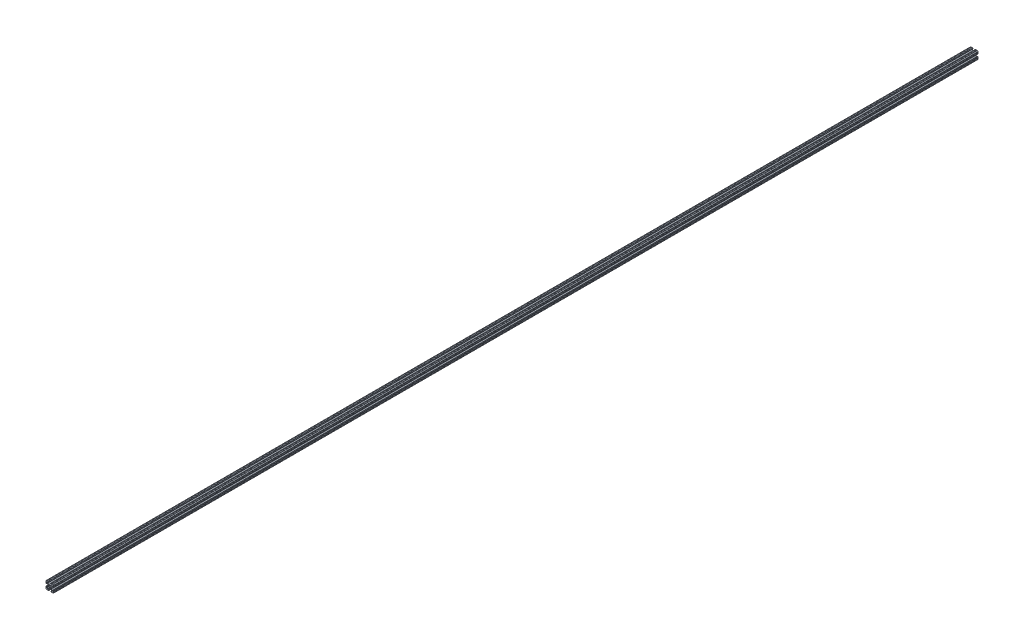
from build123d import *

# Parameters (mm, degrees)
SKETCH1_R           = 2.6035
BOSS_EXTRUDE1_DEPTH = 1524


with BuildPart() as part:
    # Sketch1 → Boss-Extrude1 (new, symmetric)
    with BuildSketch(Plane.XY):
        with BuildLine():
            Line((-7.179650497, -8.645192506), (-3.952270251, -5.423690499))
            ThreePointArc((-3.952270251, -5.423690499), (-2.922936451, -4.736929036), (-1.709253557, -4.4958))
            Line((-1.709253557, -4.4958), (1.709253557, -4.4958))
            ThreePointArc((1.709253557, -4.4958), (2.922936451, -4.736929036), (3.952270251, -5.423690499))
            Line((3.952270251, -5.423690499), (7.179650497, -8.645192506))
            ThreePointArc((7.179650497, -8.645192506), (7.41473083, -9.822813117), (6.416408329, -10.4902))
            Line((6.416408329, -10.4902), (4.287512407, -10.4902))
            ThreePointArc((4.287512407, -10.4902), (3.54574862, -10.79744862), (3.2385, -11.539212407))
            Line((3.2385, -11.539212407), (3.2385, -11.650987593))
            ThreePointArc((3.2385, -11.650987593), (3.54574862, -12.39275138), (4.287512407, -12.7))
            Line((4.287512407, -12.7), (5.317126718, -12.7))
            ThreePointArc((5.317126718, -12.7), (5.825126718, -12.192), (6.333126718, -12.7))
            Line((6.333126718, -12.7), (9.550443118, -12.7))
            ThreePointArc((9.550443118, -12.7), (10.058366869, -12.192000006), (10.566443095, -12.699847501))
            ThreePointArc((10.566443095, -12.699847501), (12.082537762, -12.08250727), (12.699846982, -10.566399977))
            ThreePointArc((12.699846982, -10.566399977), (12.192000006, -10.058323491), (12.7, -9.5504))
            Line((12.7, -9.5504), (12.7, -6.3330836))
            ThreePointArc((12.7, -6.3330836), (12.192, -5.8250836), (12.7, -5.3170836))
            Line((12.7, -5.3170836), (12.7, -4.287469289))
            ThreePointArc((12.7, -4.287469289), (12.39275138, -3.545705502), (11.650987593, -3.238456882))
            Line((11.650987593, -3.238456882), (11.539212407, -3.238456882))
            ThreePointArc((11.539212407, -3.238456882), (10.79744862, -3.545705502), (10.4902, -4.287469289))
            Line((10.4902, -4.287469289), (10.4902, -6.402089023))
            ThreePointArc((10.4902, -6.402089023), (9.856505071, -7.351067942), (8.737131347, -7.129408934))
            Line((8.737131347, -7.129408934), (5.441005833, -3.840816462))
            ThreePointArc((5.441005833, -3.840816462), (4.750877967, -2.809883091), (4.5085, -1.593185507))
            Line((4.5085, -1.593185507), (4.5085, 1.593185507))
            ThreePointArc((4.5085, 1.593185507), (4.750877967, 2.809883091), (5.441005833, 3.840816462))
            Line((5.441005833, 3.840816462), (8.737131347, 7.129408934))
            ThreePointArc((8.737131347, 7.129408934), (9.856505071, 7.351067942), (10.4902, 6.402089023))
            Line((10.4902, 6.402089023), (10.4902, 4.287469289))
            ThreePointArc((10.4902, 4.287469289), (10.79744862, 3.545705502), (11.539212407, 3.238456882))
            Line((11.539212407, 3.238456882), (11.650987593, 3.238456882))
            ThreePointArc((11.650987593, 3.238456882), (12.39275138, 3.545705502), (12.7, 4.287469289))
            Line((12.7, 4.287469289), (12.7, 5.3170836))
            ThreePointArc((12.7, 5.3170836), (12.192, 5.8250836), (12.7, 6.3330836))
            Line((12.7, 6.3330836), (12.7, 9.5504))
            ThreePointArc((12.7, 9.5504), (12.192000006, 10.058323491), (12.699846982, 10.566399977))
            ThreePointArc((12.699846982, 10.566399977), (12.082537762, 12.08250727), (10.566443095, 12.699847501))
            ThreePointArc((10.566443095, 12.699847501), (10.058366869, 12.192000006), (9.550443118, 12.7))
            Line((9.550443118, 12.7), (6.333126718, 12.7))
            ThreePointArc((6.333126718, 12.7), (5.825126718, 12.192), (5.317126718, 12.7))
            Line((5.317126718, 12.7), (4.287512407, 12.7))
            ThreePointArc((4.287512407, 12.7), (3.54574862, 12.39275138), (3.2385, 11.650987593))
            Line((3.2385, 11.650987593), (3.2385, 11.539212407))
            ThreePointArc((3.2385, 11.539212407), (3.54574862, 10.79744862), (4.287512407, 10.4902))
            Line((4.287512407, 10.4902), (6.476788598, 10.4902))
            ThreePointArc((6.476788598, 10.4902), (7.432222385, 9.85140422), (7.207036008, 8.724370562))
            Line((7.207036008, 8.724370562), (3.898272566, 5.423169045))
            ThreePointArc((3.898272566, 5.423169045), (2.869120213, 4.736787962), (1.655778399, 4.4958))
            Line((1.655778399, 4.4958), (-1.655778399, 4.4958))
            ThreePointArc((-1.655778399, 4.4958), (-2.869120213, 4.736787962), (-3.898272566, 5.423169045))
            Line((-3.898272566, 5.423169045), (-7.207036008, 8.724370562))
            ThreePointArc((-7.207036008, 8.724370562), (-7.432222385, 9.85140422), (-6.476788598, 10.4902))
            Line((-6.476788598, 10.4902), (-4.287512407, 10.4902))
            ThreePointArc((-4.287512407, 10.4902), (-3.54574862, 10.79744862), (-3.2385, 11.539212407))
            Line((-3.2385, 11.539212407), (-3.2385, 11.650987593))
            ThreePointArc((-3.2385, 11.650987593), (-3.54574862, 12.39275138), (-4.287512407, 12.7))
            Line((-4.287512407, 12.7), (-5.317126718, 12.7))
            ThreePointArc((-5.317126718, 12.7), (-5.825126718, 12.192), (-6.333126718, 12.7))
            Line((-6.333126718, 12.7), (-9.550443118, 12.7))
            ThreePointArc((-9.550443118, 12.7), (-10.058366869, 12.192000006), (-10.566443095, 12.699847501))
            ThreePointArc((-10.566443095, 12.699847501), (-12.082537762, 12.08250727), (-12.699846982, 10.566399977))
            ThreePointArc((-12.699846982, 10.566399977), (-12.192000006, 10.058323491), (-12.7, 9.5504))
            Line((-12.7, 9.5504), (-12.7, 6.3330836))
            ThreePointArc((-12.7, 6.3330836), (-12.192, 5.8250836), (-12.7, 5.3170836))
            Line((-12.7, 5.3170836), (-12.7, 4.287469289))
            ThreePointArc((-12.7, 4.287469289), (-12.39275138, 3.545705502), (-11.650987593, 3.238456882))
            Line((-11.650987593, 3.238456882), (-11.539212407, 3.238456882))
            ThreePointArc((-11.539212407, 3.238456882), (-10.79744862, 3.545705502), (-10.4902, 4.287469289))
            Line((-10.4902, 4.287469289), (-10.4902, 6.402089023))
            ThreePointArc((-10.4902, 6.402089023), (-9.856505071, 7.351067942), (-8.737131347, 7.129408934))
            Line((-8.737131347, 7.129408934), (-5.441005833, 3.840816462))
            ThreePointArc((-5.441005833, 3.840816462), (-4.750877967, 2.809883091), (-4.5085, 1.593185507))
            Line((-4.5085, 1.593185507), (-4.5085, -1.593185507))
            ThreePointArc((-4.5085, -1.593185507), (-4.750877967, -2.809883091), (-5.441005833, -3.840816462))
            Line((-5.441005833, -3.840816462), (-8.737131347, -7.129408934))
            ThreePointArc((-8.737131347, -7.129408934), (-9.856505071, -7.351067942), (-10.4902, -6.402089023))
            Line((-10.4902, -6.402089023), (-10.4902, -4.287469289))
            ThreePointArc((-10.4902, -4.287469289), (-10.79744862, -3.545705502), (-11.539212407, -3.238456882))
            Line((-11.539212407, -3.238456882), (-11.650987593, -3.238456882))
            ThreePointArc((-11.650987593, -3.238456882), (-12.39275138, -3.545705502), (-12.7, -4.287469289))
            Line((-12.7, -4.287469289), (-12.7, -5.3170836))
            ThreePointArc((-12.7, -5.3170836), (-12.192, -5.8250836), (-12.7, -6.3330836))
            Line((-12.7, -6.3330836), (-12.7, -9.5504))
            ThreePointArc((-12.7, -9.5504), (-12.192000006, -10.058323491), (-12.699846982, -10.566399977))
            ThreePointArc((-12.699846982, -10.566399977), (-12.082537762, -12.08250727), (-10.566443095, -12.699847501))
            ThreePointArc((-10.566443095, -12.699847501), (-10.058366869, -12.192000006), (-9.550443118, -12.7))
            Line((-9.550443118, -12.7), (-6.333126718, -12.7))
            ThreePointArc((-6.333126718, -12.7), (-5.825126718, -12.192), (-5.317126718, -12.7))
            Line((-5.317126718, -12.7), (-4.287512407, -12.7))
            ThreePointArc((-4.287512407, -12.7), (-3.54574862, -12.39275138), (-3.2385, -11.650987593))
            Line((-3.2385, -11.650987593), (-3.2385, -11.539212407))
            ThreePointArc((-3.2385, -11.539212407), (-3.54574862, -10.79744862), (-4.287512407, -10.4902))
            Line((-4.287512407, -10.4902), (-6.416408329, -10.4902))
            ThreePointArc((-6.416408329, -10.4902), (-7.41473083, -9.822813117), (-7.179650497, -8.645192506))
        make_face()
        Circle(SKETCH1_R, mode=Mode.SUBTRACT)
    extrude(amount=BOSS_EXTRUDE1_DEPTH, both=True)


solid = part.part
